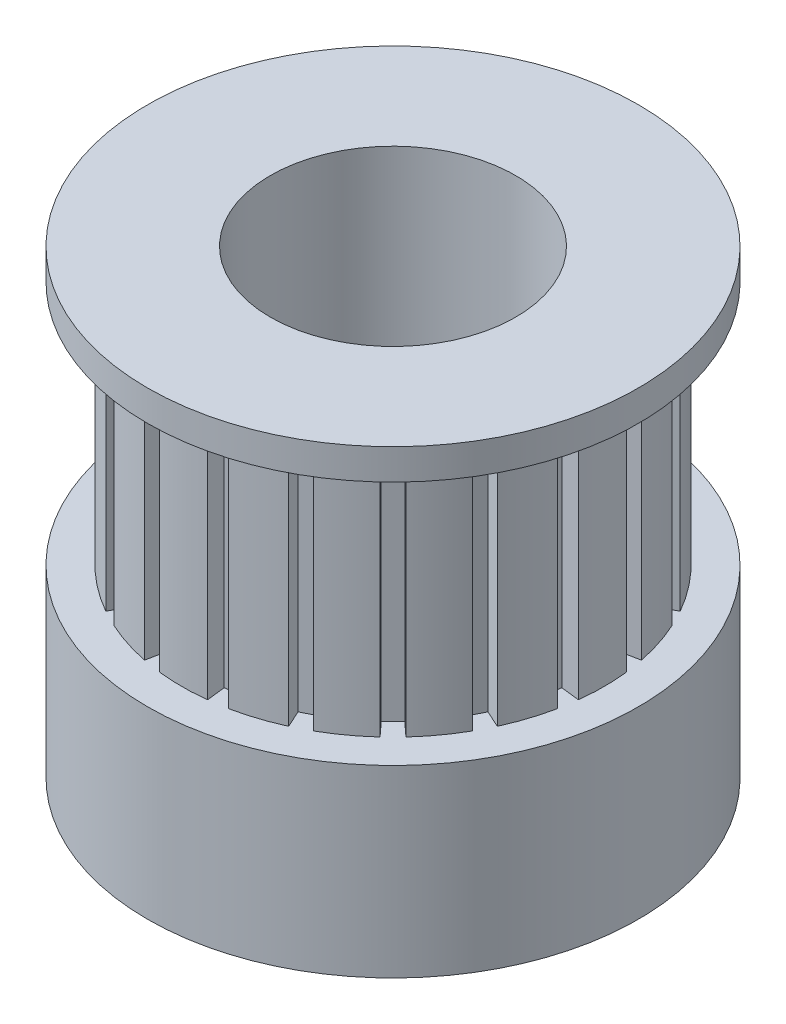
from build123d import *

# Parameters (mm, degrees)
SKETCH_1_R          = 8
EXTRUDE_1_DEPTH     = 6
SKETCH_2_R          = 6.870177757
EXTRUDE_2_DEPTH     = 8
CUT_EXTRUDE_START   = -8
CUT_EXTRUDE_1_DEPTH = 8
SKETCH_4_R          = 8
EXTRUDE_3_DEPTH     = 1
SKETCH_5_R          = 4
CUT_EXTRUDE_2_DEPTH = 19.788294228


with BuildPart() as part:
    # 草图1 → 凸台-拉伸1 (new body)
    with BuildSketch(Plane(origin=(0, 0, 0), x_dir=(1, 0, 0), z_dir=(0, 1, 0))):
        with Locations(Location((0, 0, 0), (0, 0, 270))):
            Circle(SKETCH_1_R)
    extrude(amount=EXTRUDE_1_DEPTH)

    # 草图2 → 凸台-拉伸2 (add)
    with BuildSketch(Plane(origin=(0, 6, 0), x_dir=(1, 0, 0), z_dir=(0, 1, 0))):
        with Locations(Location((0, 0, 0), (0, 0, 270))):
            Circle(SKETCH_2_R)
    extrude(amount=EXTRUDE_2_DEPTH)

    # 草图3 → 切除-拉伸1 (cut)
    with BuildSketch(Plane(origin=(0, 14, 0), x_dir=(1, 0, 0), z_dir=(0, 1, 0)).offset(CUT_EXTRUDE_START)):
        with BuildLine():
            Line((-0.70957594, 6.214911676), (-0.774732582, 6.785594468))
            Line((-0.774732582, 6.785594468), (-0.779326709, 6.825832718))
            ThreePointArc((-0.779326709, 6.825832718), (-1.074732582, 6.785594468), (-1.368114565, 6.732577883))
            Line((-1.368114565, 6.732577883), (-1.360049537, 6.69288937))
            Line((-1.360049537, 6.69288937), (-1.245666505, 6.130003271))
            Line((-1.245666505, 6.130003271), (-0.977621222, 6.172457473))
            Line((-0.977621222, 6.172457473), (-0.70957594, 6.214911676))
        make_face()
        with BuildLine():
            Line((1.245666505, 6.130003271), (1.360049537, 6.69288937))
            Line((1.360049537, 6.69288937), (1.368114565, 6.732577883))
            ThreePointArc((1.368114565, 6.732577883), (1.074732582, 6.785594468), (0.779326709, 6.825832718))
            Line((0.779326709, 6.825832718), (0.774732582, 6.785594468))
            Line((0.774732582, 6.785594468), (0.70957594, 6.214911676))
            Line((0.70957594, 6.214911676), (0.977621222, 6.172457473))
            Line((0.977621222, 6.172457473), (1.245666505, 6.130003271))
        make_face()
        with BuildLine():
            Line((3.078974433, 5.445047437), (3.361700531, 5.945037628))
            Line((3.361700531, 5.945037628), (3.381635254, 5.980291416))
            ThreePointArc((3.381635254, 5.980291416), (3.118995433, 6.121373204), (2.850482056, 6.250927488))
            Line((2.850482056, 6.250927488), (2.833678478, 6.214078302))
            Line((2.833678478, 6.214078302), (2.595360147, 5.691461223))
            Line((2.595360147, 5.691461223), (2.83716729, 5.56825433))
            Line((2.83716729, 5.56825433), (3.078974433, 5.445047437))
        make_face()
        with BuildLine():
            Line((4.610890891, 4.227092421), (5.034284855, 4.615244181))
            Line((5.034284855, 4.615244181), (5.064137923, 4.642612358))
            ThreePointArc((5.064137923, 4.642612358), (4.85794928, 4.85794928), (4.642612358, 5.064137923))
            Line((4.642612358, 5.064137923), (4.615244181, 5.034284855))
            Line((4.615244181, 5.034284855), (4.227092421, 4.610890891))
            Line((4.227092421, 4.610890891), (4.418991656, 4.418991656))
            Line((4.418991656, 4.418991656), (4.610890891, 4.227092421))
        make_face()
        with BuildLine():
            Line((5.691461223, 2.595360147), (6.214078302, 2.833678478))
            Line((6.214078302, 2.833678478), (6.250927488, 2.850482056))
            ThreePointArc((6.250927488, 2.850482056), (6.121373204, 3.118995433), (5.980291416, 3.381635254))
            Line((5.980291416, 3.381635254), (5.945037628, 3.361700531))
            Line((5.945037628, 3.361700531), (5.445047437, 3.078974433))
            Line((5.445047437, 3.078974433), (5.56825433, 2.83716729))
            Line((5.56825433, 2.83716729), (5.691461223, 2.595360147))
        make_face()
        with BuildLine():
            Line((6.214911676, 0.70957594), (6.785594468, 0.774732582))
            Line((6.785594468, 0.774732582), (6.825832718, 0.779326709))
            ThreePointArc((6.825832718, 0.779326709), (6.785594468, 1.074732582), (6.732577883, 1.368114565))
            Line((6.732577883, 1.368114565), (6.69288937, 1.360049537))
            Line((6.69288937, 1.360049537), (6.130003271, 1.245666505))
            Line((6.130003271, 1.245666505), (6.172457473, 0.977621222))
            Line((6.172457473, 0.977621222), (6.214911676, 0.70957594))
        make_face()
        with BuildLine():
            Line((6.130003271, -1.245666505), (6.69288937, -1.360049537))
            Line((6.69288937, -1.360049537), (6.732577883, -1.368114565))
            ThreePointArc((6.732577883, -1.368114565), (6.785594468, -1.074732582), (6.825832718, -0.779326709))
            Line((6.825832718, -0.779326709), (6.785594468, -0.774732582))
            Line((6.785594468, -0.774732582), (6.214911676, -0.70957594))
            Line((6.214911676, -0.70957594), (6.172457473, -0.977621222))
            Line((6.172457473, -0.977621222), (6.130003271, -1.245666505))
        make_face()
        with BuildLine():
            Line((5.445047437, -3.078974433), (5.945037628, -3.361700531))
            Line((5.945037628, -3.361700531), (5.980291416, -3.381635254))
            ThreePointArc((5.980291416, -3.381635254), (6.121373204, -3.118995433), (6.250927488, -2.850482056))
            Line((6.250927488, -2.850482056), (6.214078302, -2.833678478))
            Line((6.214078302, -2.833678478), (5.691461223, -2.595360147))
            Line((5.691461223, -2.595360147), (5.56825433, -2.83716729))
            Line((5.56825433, -2.83716729), (5.445047437, -3.078974433))
        make_face()
        with BuildLine():
            Line((4.227092421, -4.610890891), (4.615244181, -5.034284855))
            Line((4.615244181, -5.034284855), (4.642612358, -5.064137923))
            ThreePointArc((4.642612358, -5.064137923), (4.85794928, -4.85794928), (5.064137923, -4.642612358))
            Line((5.064137923, -4.642612358), (5.034284855, -4.615244181))
            Line((5.034284855, -4.615244181), (4.610890891, -4.227092421))
            Line((4.610890891, -4.227092421), (4.418991656, -4.418991656))
            Line((4.418991656, -4.418991656), (4.227092421, -4.610890891))
        make_face()
        with BuildLine():
            Line((2.595360147, -5.691461223), (2.833678478, -6.214078302))
            Line((2.833678478, -6.214078302), (2.850482056, -6.250927488))
            ThreePointArc((2.850482056, -6.250927488), (3.118995433, -6.121373204), (3.381635254, -5.980291416))
            Line((3.381635254, -5.980291416), (3.361700531, -5.945037628))
            Line((3.361700531, -5.945037628), (3.078974433, -5.445047437))
            Line((3.078974433, -5.445047437), (2.83716729, -5.56825433))
            Line((2.83716729, -5.56825433), (2.595360147, -5.691461223))
        make_face()
        with BuildLine():
            Line((0.70957594, -6.214911676), (0.774732582, -6.785594468))
            Line((0.774732582, -6.785594468), (0.779326709, -6.825832718))
            ThreePointArc((0.779326709, -6.825832718), (1.074732582, -6.785594468), (1.368114565, -6.732577883))
            Line((1.368114565, -6.732577883), (1.360049537, -6.69288937))
            Line((1.360049537, -6.69288937), (1.245666505, -6.130003271))
            Line((1.245666505, -6.130003271), (0.977621222, -6.172457473))
            Line((0.977621222, -6.172457473), (0.70957594, -6.214911676))
        make_face()
        with BuildLine():
            Line((-1.245666505, -6.130003271), (-1.360049537, -6.69288937))
            Line((-1.360049537, -6.69288937), (-1.368114565, -6.732577883))
            ThreePointArc((-1.368114565, -6.732577883), (-1.074732582, -6.785594468), (-0.779326709, -6.825832718))
            Line((-0.779326709, -6.825832718), (-0.774732582, -6.785594468))
            Line((-0.774732582, -6.785594468), (-0.70957594, -6.214911676))
            Line((-0.70957594, -6.214911676), (-0.977621222, -6.172457473))
            Line((-0.977621222, -6.172457473), (-1.245666505, -6.130003271))
        make_face()
        with BuildLine():
            Line((-3.078974433, -5.445047437), (-3.361700531, -5.945037628))
            Line((-3.361700531, -5.945037628), (-3.381635254, -5.980291416))
            ThreePointArc((-3.381635254, -5.980291416), (-3.118995433, -6.121373204), (-2.850482056, -6.250927488))
            Line((-2.850482056, -6.250927488), (-2.833678478, -6.214078302))
            Line((-2.833678478, -6.214078302), (-2.595360147, -5.691461223))
            Line((-2.595360147, -5.691461223), (-2.83716729, -5.56825433))
            Line((-2.83716729, -5.56825433), (-3.078974433, -5.445047437))
        make_face()
        with BuildLine():
            Line((-4.610890891, -4.227092421), (-5.034284855, -4.615244181))
            Line((-5.034284855, -4.615244181), (-5.064137923, -4.642612358))
            ThreePointArc((-5.064137923, -4.642612358), (-4.85794928, -4.85794928), (-4.642612358, -5.064137923))
            Line((-4.642612358, -5.064137923), (-4.615244181, -5.034284855))
            Line((-4.615244181, -5.034284855), (-4.227092421, -4.610890891))
            Line((-4.227092421, -4.610890891), (-4.418991656, -4.418991656))
            Line((-4.418991656, -4.418991656), (-4.610890891, -4.227092421))
        make_face()
        with BuildLine():
            Line((-5.691461223, -2.595360147), (-6.214078302, -2.833678478))
            Line((-6.214078302, -2.833678478), (-6.250927488, -2.850482056))
            ThreePointArc((-6.250927488, -2.850482056), (-6.121373204, -3.118995433), (-5.980291416, -3.381635254))
            Line((-5.980291416, -3.381635254), (-5.945037628, -3.361700531))
            Line((-5.945037628, -3.361700531), (-5.445047437, -3.078974433))
            Line((-5.445047437, -3.078974433), (-5.56825433, -2.83716729))
            Line((-5.56825433, -2.83716729), (-5.691461223, -2.595360147))
        make_face()
        with BuildLine():
            Line((-6.214911676, -0.70957594), (-6.785594468, -0.774732582))
            Line((-6.785594468, -0.774732582), (-6.825832718, -0.779326709))
            ThreePointArc((-6.825832718, -0.779326709), (-6.785594468, -1.074732582), (-6.732577883, -1.368114565))
            Line((-6.732577883, -1.368114565), (-6.69288937, -1.360049537))
            Line((-6.69288937, -1.360049537), (-6.130003271, -1.245666505))
            Line((-6.130003271, -1.245666505), (-6.172457473, -0.977621222))
            Line((-6.172457473, -0.977621222), (-6.214911676, -0.70957594))
        make_face()
        with BuildLine():
            Line((-6.130003271, 1.245666505), (-6.69288937, 1.360049537))
            Line((-6.69288937, 1.360049537), (-6.732577883, 1.368114565))
            ThreePointArc((-6.732577883, 1.368114565), (-6.785594468, 1.074732582), (-6.825832718, 0.779326709))
            Line((-6.825832718, 0.779326709), (-6.785594468, 0.774732582))
            Line((-6.785594468, 0.774732582), (-6.214911676, 0.70957594))
            Line((-6.214911676, 0.70957594), (-6.172457473, 0.977621222))
            Line((-6.172457473, 0.977621222), (-6.130003271, 1.245666505))
        make_face()
        with BuildLine():
            Line((-5.445047437, 3.078974433), (-5.945037628, 3.361700531))
            Line((-5.945037628, 3.361700531), (-5.980291416, 3.381635254))
            ThreePointArc((-5.980291416, 3.381635254), (-6.121373204, 3.118995433), (-6.250927488, 2.850482056))
            Line((-6.250927488, 2.850482056), (-6.214078302, 2.833678478))
            Line((-6.214078302, 2.833678478), (-5.691461223, 2.595360147))
            Line((-5.691461223, 2.595360147), (-5.56825433, 2.83716729))
            Line((-5.56825433, 2.83716729), (-5.445047437, 3.078974433))
        make_face()
        with BuildLine():
            Line((-4.227092421, 4.610890891), (-4.615244181, 5.034284855))
            Line((-4.615244181, 5.034284855), (-4.642612358, 5.064137923))
            ThreePointArc((-4.642612358, 5.064137923), (-4.85794928, 4.85794928), (-5.064137923, 4.642612358))
            Line((-5.064137923, 4.642612358), (-5.034284855, 4.615244181))
            Line((-5.034284855, 4.615244181), (-4.610890891, 4.227092421))
            Line((-4.610890891, 4.227092421), (-4.418991656, 4.418991656))
            Line((-4.418991656, 4.418991656), (-4.227092421, 4.610890891))
        make_face()
        with BuildLine():
            Line((-2.595360147, 5.691461223), (-2.833678478, 6.214078302))
            Line((-2.833678478, 6.214078302), (-2.850482056, 6.250927488))
            ThreePointArc((-2.850482056, 6.250927488), (-3.118995433, 6.121373204), (-3.381635254, 5.980291416))
            Line((-3.381635254, 5.980291416), (-3.361700531, 5.945037628))
            Line((-3.361700531, 5.945037628), (-3.078974433, 5.445047437))
            Line((-3.078974433, 5.445047437), (-2.83716729, 5.56825433))
            Line((-2.83716729, 5.56825433), (-2.595360147, 5.691461223))
        make_face()
    extrude(amount=CUT_EXTRUDE_1_DEPTH, mode=Mode.SUBTRACT)

    # 草图4 → 凸台-拉伸3 (add)
    with BuildSketch(Plane(origin=(0, 14, 0), x_dir=(1, 0, 0), z_dir=(0, 1, 0))):
        with Locations(Location((0, 0, 0), (0, 0, 270))):
            Circle(SKETCH_4_R)
    extrude(amount=EXTRUDE_3_DEPTH)

    # 草图5 → 切除-拉伸2 (cut, through all)
    with BuildSketch(Plane(origin=(0, 15, 0), x_dir=(1, 0, 0), z_dir=(0, 1, 0))):
        with Locations(Location((0, 0, 0), (0, 0, 270))):
            Circle(SKETCH_5_R)
    extrude(amount=-CUT_EXTRUDE_2_DEPTH, mode=Mode.SUBTRACT)


solid = part.part
